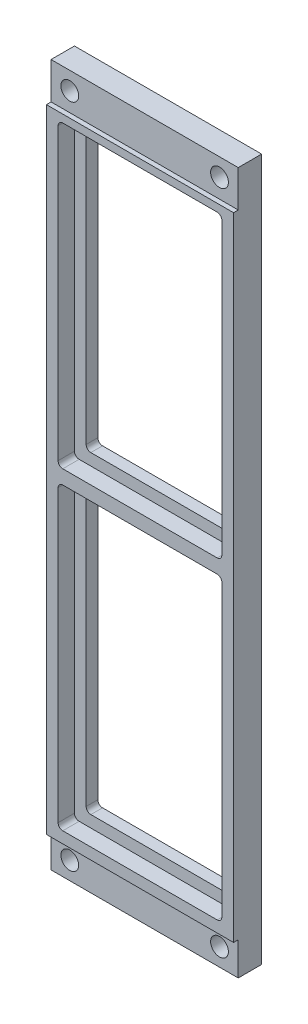
from build123d import *

# Parameters (mm, degrees)
SKETCH_1_W          = 40
SKETCH_1_H          = 150
EXTRUDE_1_DEPTH     = 6
SKETCH_2_R          = 1.9
CUT_EXTRUDE_1_DEPTH = 156.357651888
SKETCH_3_W          = 30
SKETCH_3_H          = 59
CUT_EXTRUDE_2_DEPTH = 156.357651888
SKETCH_4_W          = 35
SKETCH_4_H          = 64
CUT_EXTRUDE_3_DEPTH = 3.5
SKETCH_5_W          = 40
SKETCH_5_H          = 7.078158815
SKETCH_5_H_2        = 7.85
CUT_EXTRUDE_4_DEPTH = 1
FILLET_1_R          = 1


with BuildPart() as part:
    # ｽｹｯﾁ1 → ﾎﾞｽ - 押し出し1 (new body)
    with BuildSketch(Plane.XY):
        with Locations((20, 75)):
            Rectangle(SKETCH_1_W, SKETCH_1_H)
    extrude(amount=EXTRUDE_1_DEPTH)

    # ｽｹｯﾁ2 → ｶｯﾄ - 押し出し1 (cut, through all)
    with BuildSketch(Plane.XY.offset(6)):
        with Locations((36, 146.2)):
            Circle(SKETCH_2_R)
        with Locations((4, 146.2)):
            Circle(SKETCH_2_R)
        with Locations((4, 3.8)):
            Circle(SKETCH_2_R)
        with Locations((36, 3.8)):
            Circle(SKETCH_2_R)
    extrude(amount=-CUT_EXTRUDE_1_DEPTH, mode=Mode.SUBTRACT)

    # ｽｹｯﾁ3 → ｶｯﾄ - 押し出し2 (cut, through all)
    with BuildSketch(Plane.XY.offset(6)):
        with Locations((20, 108.5)):
            Rectangle(SKETCH_3_W, SKETCH_3_H)
        with Locations((20, 41.5)):
            Rectangle(SKETCH_3_W, SKETCH_3_H)
    extrude(amount=-CUT_EXTRUDE_2_DEPTH, mode=Mode.SUBTRACT)

    # ｽｹｯﾁ4 → ｶｯﾄ - 押し出し3 (cut)
    with BuildSketch(Plane.XY.offset(6)):
        with Locations((20, 108.5)):
            Rectangle(SKETCH_4_W, SKETCH_4_H)
        with Locations((20, 41.5)):
            Rectangle(SKETCH_4_W, SKETCH_4_H)
    extrude(amount=-CUT_EXTRUDE_3_DEPTH, mode=Mode.SUBTRACT)

    # ｽｹｯﾁ5 → ｶｯﾄ - 押し出し4 (cut)
    with BuildSketch(Plane.XY.offset(6)):
        with Locations((20, 3.539079408)):
            Rectangle(SKETCH_5_W, SKETCH_5_H)
        with Locations((20, 146.075)):
            Rectangle(SKETCH_5_W, SKETCH_5_H_2)
    extrude(amount=-CUT_EXTRUDE_4_DEPTH, mode=Mode.SUBTRACT)

    # ﾌｨﾚｯﾄ1
    fillet_1_edges = [part.edges().sort_by_distance(p)[0] for p in [
        (35, 138, 1.25),
        (35, 79, 1.25),
        (5, 79, 1.25),
        (5, 138, 1.25),
        (35, 71, 1.25),
        (35, 12, 1.25),
        (5, 12, 1.25),
        (5, 71, 1.25),
        (2.5, 76.5, 4.25),
        (2.5, 140.5, 4.25),
        (37.5, 140.5, 4.25),
        (37.5, 76.5, 4.25),
        (2.5, 9.5, 4.25),
        (2.5, 73.5, 4.25),
        (37.5, 73.5, 4.25),
        (37.5, 9.5, 4.25),
    ]]
    fillet(fillet_1_edges, radius=FILLET_1_R)


solid = part.part
